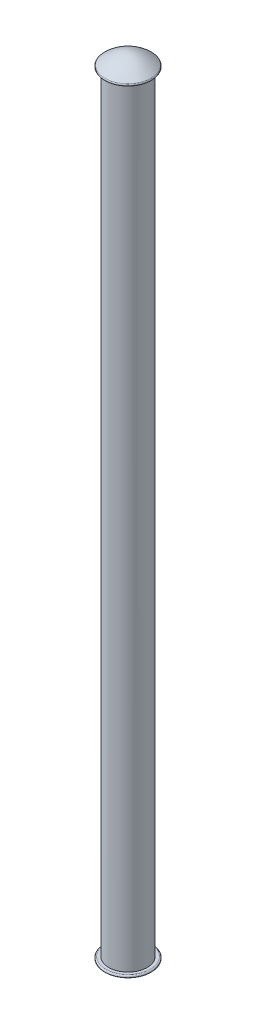
from build123d import *

# Parameters (mm, degrees)
SKETCH1_R           = 1.5
BOSS_EXTRUDE1_DEPTH = 30


with BuildPart() as part:
    # Sketch1 → Boss-Extrude1 (new, symmetric)
    with BuildSketch(Plane(origin=(0, 0, 0), x_dir=(1, 0, 0), z_dir=(0, 1, 0))):
        with Locations(Location((0, 0, 0), (0, 0, 270))):
            Circle(SKETCH1_R)
    extrude(amount=BOSS_EXTRUDE1_DEPTH, both=True)

    # Sketch2 → Revolve1 (revolve)
    with BuildSketch(Plane.XY):
        with BuildLine():
            Line((0, 30), (-1.731543481, 30))
            ThreePointArc((-1.731543481, 30), (-1.825836483, 30.066700905), (-1.794340914, 30.177823405))
            add(Edge.make_bspline(
                [(-1.794340914, 30.177823405), (-1.296972614, 30.579160925), (-0.657911989, 31), (0, 31)],
                knots=[0, 0, 0, 0, 1, 1, 1, 1], degree=3))
            Line((0, 31), (0, 30))
        make_face()
    revolve1 = revolve(axis=Axis((0, 31, 0), (0, -1, 0)))

    # Mirror1: Revolve1 across plane
    add(revolve1.mirror(Plane.ZX))


solid = part.part
